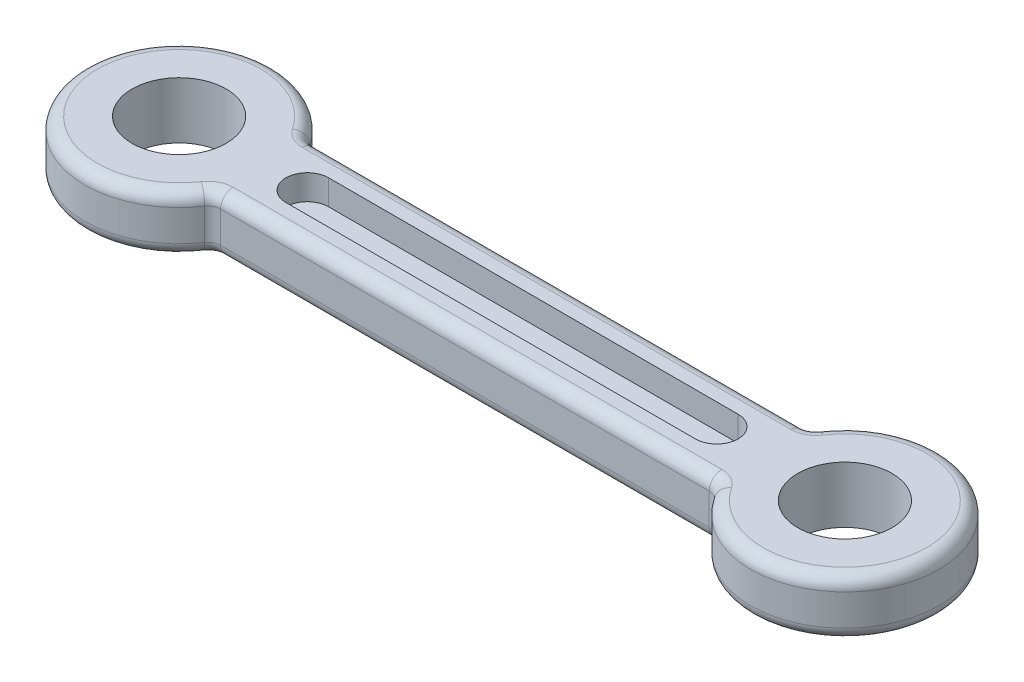
from build123d import *

# Parameters (mm, degrees)
SKETCH1_R           = 19.05
BOSS_EXTRUDE1_DEPTH = 11.43
CUT_EXTRUDE1_DEPTH  = 10.16
FILLET1_R           = 5.08
FILLET2_R           = 5.08


with BuildPart() as part:
    # Sketch1 → Boss-Extrude1 (new, symmetric)
    with BuildSketch(Plane(origin=(0, 0, 0), x_dir=(1, 0, 0), z_dir=(0, 1, 0))):
        with BuildLine():
            Line((-101.6, 19.05), (101.6, 19.05))
            ThreePointArc((101.6, 19.05), (172.695567884, 0), (101.6, -19.05))
            Line((101.6, -19.05), (-101.6, -19.05))
            ThreePointArc((-101.6, -19.05), (-172.695567884, 0), (-101.6, 19.05))
        make_face()
        with Locations(Location((-134.595567884, 0, 0), (0, 0, 270))):
            Circle(SKETCH1_R, mode=Mode.SUBTRACT)
        with Locations(Location((134.595567884, 0, 0), (0, 0, 90))):
            Circle(SKETCH1_R, mode=Mode.SUBTRACT)
    extrude(amount=BOSS_EXTRUDE1_DEPTH, both=True)

    # Sketch2 → Cut-Extrude1 (cut)
    with BuildSketch(Plane(origin=(0, 11.43, 0), x_dir=(1, 0, 0), z_dir=(0, 1, 0))):
        with BuildLine():
            Line((-82.77922336, 8.645829995), (82.77922336, 8.645829995))
            ThreePointArc((82.77922336, 8.645829995), (91.425053355, 0), (82.77922336, -8.645829995))
            Line((82.77922336, -8.645829995), (-82.77922336, -8.645829995))
            ThreePointArc((-82.77922336, -8.645829995), (-91.425053355, 0), (-82.77922336, 8.645829995))
        make_face()
    cut_extrude1 = extrude(amount=-CUT_EXTRUDE1_DEPTH, mode=Mode.SUBTRACT)

    # Mirror2: Cut-Extrude1 across plane
    add(cut_extrude1.mirror(Plane.ZX), mode=Mode.SUBTRACT)

    # Fillet1
    fillet1_edges = [part.edges().sort_by_distance(p)[0] for p in [
        (101.6, 0, 19.05),
        (-101.6, 0, 19.05),
        (-101.6, 0, -19.05),
        (101.6, 0, -19.05),
    ]]
    fillet(fillet1_edges, radius=FILLET1_R)

    # Fillet2
    fillet2_edges = [part.edges().sort_by_distance(p)[0] for p in [
        (-172.695567884, -11.43, 0),
        (-172.695567884, 11.43, 0),
        (0, -11.43, -19.05),
        (0, 11.43, -19.05),
        (0, -11.43, 19.05),
        (0, 11.43, 19.05),
        (172.695567884, -11.43, 0),
        (172.695567884, 11.43, 0),
        (-101.172887096, -11.43, -19.645157554),
        (-101.172887096, 11.43, -19.645157554),
        (-101.172887096, -11.43, 19.645157554),
        (-101.172887096, 11.43, 19.645157554),
        (101.172887096, -11.43, 19.645157554),
        (101.172887096, 11.43, 19.645157554),
        (101.172887096, -11.43, -19.645157554),
        (101.172887096, 11.43, -19.645157554),
    ]]
    fillet(fillet2_edges, radius=FILLET2_R)


solid = part.part
